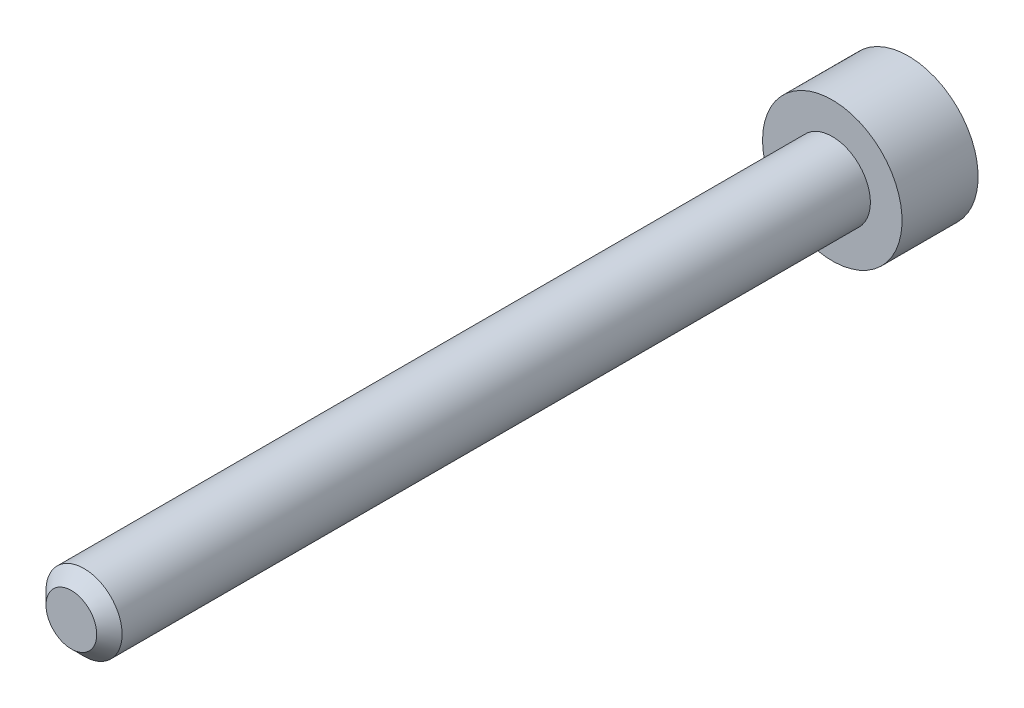
from build123d import *

# Parameters (mm, degrees)
ESQUISSE2_R      = 1.5
EXTRUSION1_DEPTH = 30
ESQUISSE3_R      = 2.75
EXTRUSION2_DEPTH = 3
CHANFREIN1_SIZE  = 0.5


with BuildPart() as part:
    # Esquisse2 → Extrusion1 (new body)
    with BuildSketch(Plane.XY):
        Circle(ESQUISSE2_R)
    extrude(amount=EXTRUSION1_DEPTH)

    # Esquisse3 → Extrusion2 (add)
    with BuildSketch(Plane(origin=(0, 0, 0), x_dir=(-1, 0, 0), z_dir=(0, 0, -1))):
        Circle(ESQUISSE3_R)
    extrude(amount=EXTRUSION2_DEPTH)

    # Chanfrein1
    chanfrein1_edges = [part.edges().sort_by_distance(p)[0] for p in [
        (-1.5, 0, 30),
    ]]
    chamfer(chanfrein1_edges, length=CHANFREIN1_SIZE)


solid = part.part
